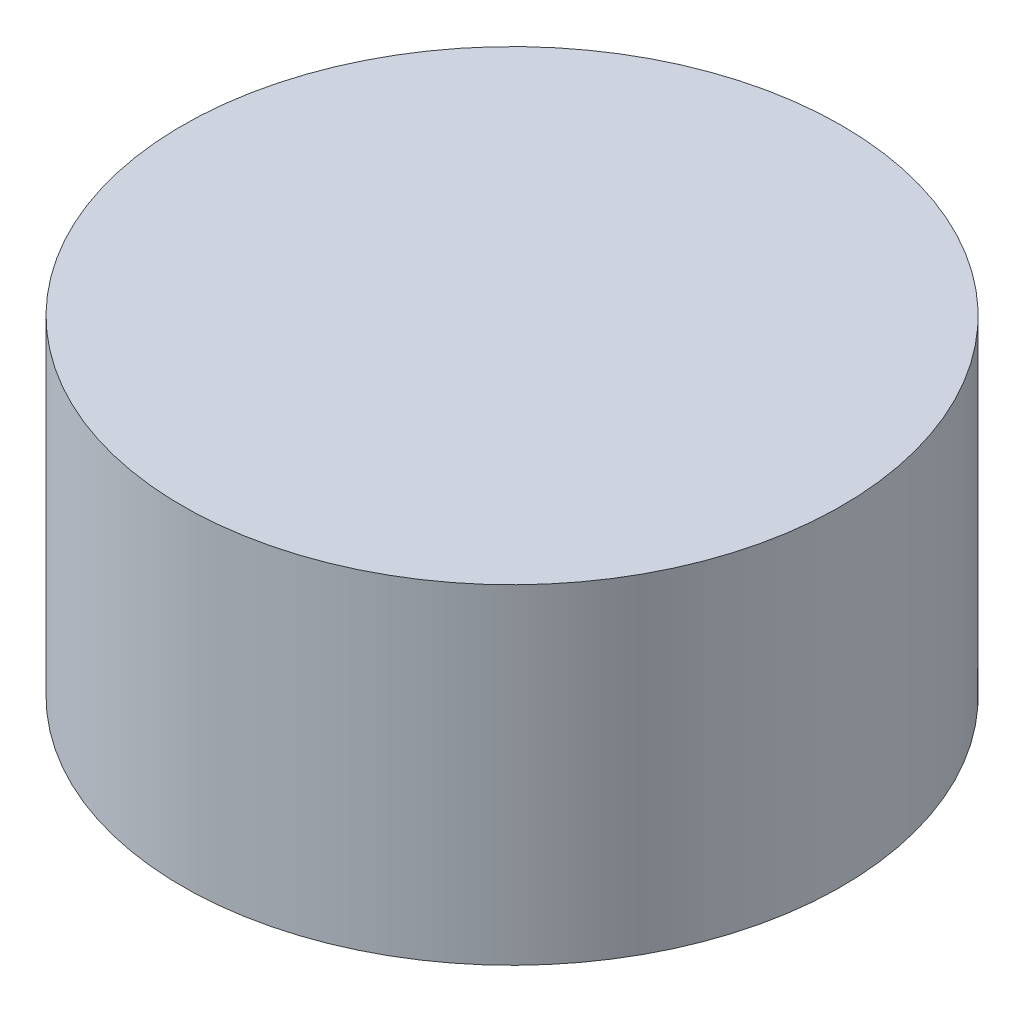
from build123d import *

# Parameters (mm, degrees)
SKETCH_8_W = 100
SKETCH_8_H = 100


with BuildPart() as part:
    # 草图8 → 旋转3 (revolve)
    with BuildSketch(Plane.XY, mode=Mode.PRIVATE) as revolve_3_sk:
        Rectangle(SKETCH_8_W, SKETCH_8_H)
    revolve(revolve_3_sk.sketch.rotate(Axis((50, -50, 0), (0, 1, 0)), 270), axis=Axis((50, -50, 0), (0, 1, 0)))


solid = part.part
